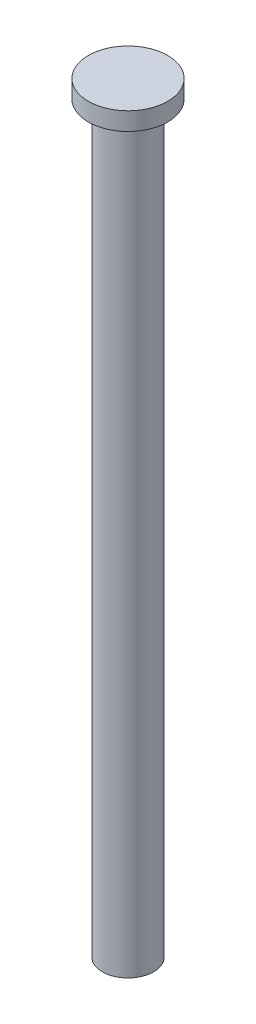
from build123d import *


with BuildPart() as part:
    # Sketch1 → Revolve1 (revolve)
    with BuildSketch(Plane.XY, mode=Mode.PRIVATE) as revolve1_sk:
        Polygon((10, 0), (8.47, 0), (8.47, 290), (0, 290), (0, 297), (15.5, 297), (15.5, 290), (10, 290), align=None)
    revolve(revolve1_sk.sketch.rotate(Axis((0, 0, 0), (0, 1, 0)), 90), axis=Axis((0, 0, 0), (0, 1, 0)))


solid = part.part
